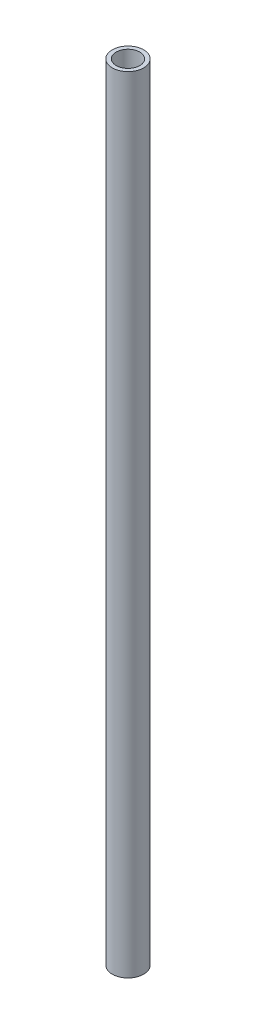
from build123d import *

# Parameters (mm, degrees)
SKETCH_1_R      = 20
SKETCH_1_R_2    = 15
EXTRUDE_1_DEPTH = 1000


with BuildPart() as part:
    # Эскиз1 → Бобышка-Вытянуть1 (new body)
    with BuildSketch(Plane(origin=(0, 0, 0), x_dir=(1, 0, 0), z_dir=(0, 1, 0))):
        with Locations(Location((0, 0, 0), (0, 0, 270))):
            Circle(SKETCH_1_R)
        with Locations(Location((0, 0, 0), (0, 0, 270))):
            Circle(SKETCH_1_R_2, mode=Mode.SUBTRACT)
    extrude(amount=EXTRUDE_1_DEPTH)


solid = part.part
